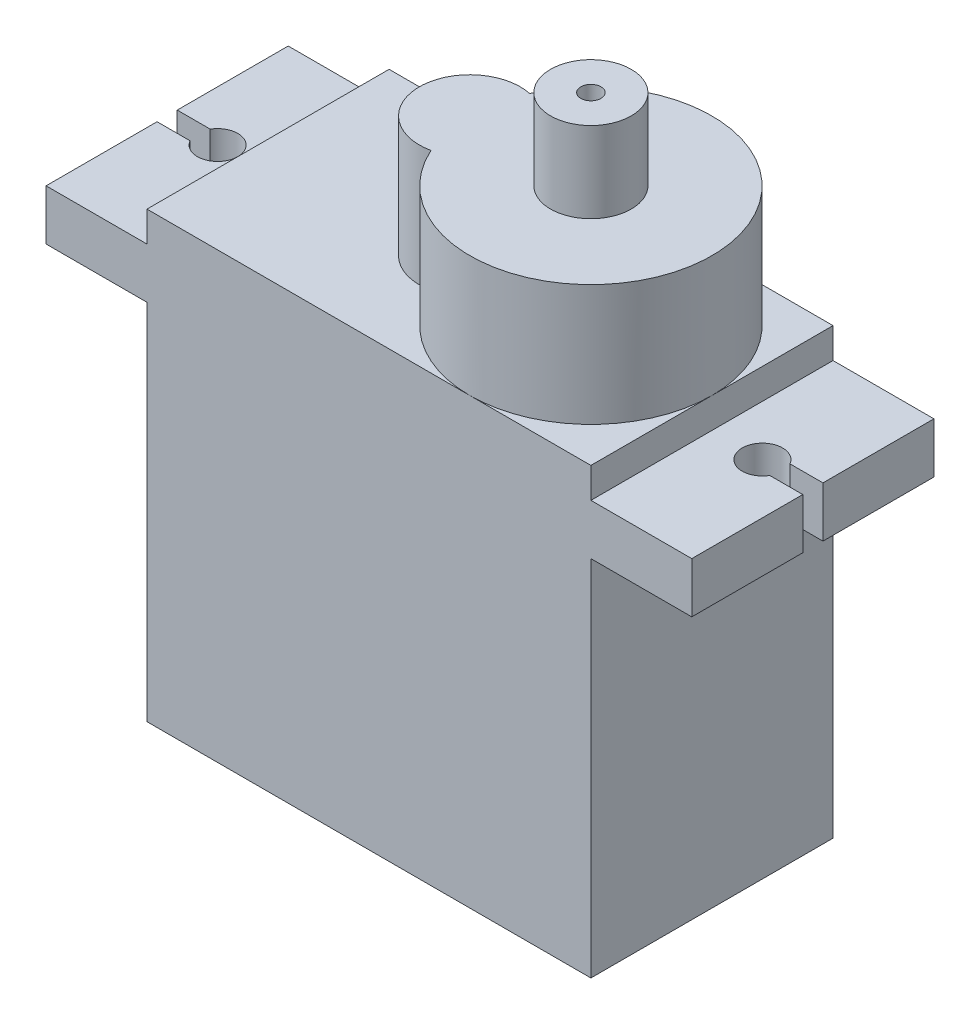
from build123d import *

# Parameters (mm, degrees)
EXTRUDE_5_DEPTH     = 12
EXTRUDE_6_DEPTH     = 6
SKETCH_11_R         = 2
SKETCH_11_R_2       = 0.5
EXTRUDE_7_DEPTH     = 4
CUT_EXTRUDE_4_DEPTH = 3
SKETCH_15_R         = 0.5
CUT_EXTRUDE_5_DEPTH = 38.735924528


with BuildPart() as part:
    # 草图9 → 凸台-拉伸5 (new body)
    with BuildSketch(Plane.XY):
        Polygon((11, -16.590909091), (-11, -16.590909091), (-11, 1.409090909), (-16, 1.409090909), (-16, 3.909090909), (-11, 3.909090909), (-11, 5.409090909), (11, 5.409090909), (11, 3.909090909), (16, 3.909090909), (16, 1.409090909), (11, 1.409090909), align=None)
    extrude(amount=EXTRUDE_5_DEPTH)

    # 草图10 → 凸台-拉伸6 (add)
    with BuildSketch(Plane(origin=(0, 5.409090909, 0), x_dir=(-1, 0, 0), z_dir=(0, -1, 0))):
        with BuildLine():
            ThreePointArc((0.479166667, -3.554855293), (-11, -6), (0.479166667, -8.445144707))
            ThreePointArc((0.479166667, -8.445144707), (3.5, -6), (0.479166667, -3.554855293))
        make_face()
    extrude(amount=-EXTRUDE_6_DEPTH)

    # 草图11 → 凸台-拉伸7 (add)
    with BuildSketch(Plane(origin=(0, 11.409090909, 0), x_dir=(-1, 0, 0), z_dir=(0, -1, 0))):
        with Locations(Location((-5, -6, 0), (0, 0, 90))):
            Circle(SKETCH_11_R)
        with Locations(Location((-5, -6, 0), (0, 0, 90))):
            Circle(SKETCH_11_R_2, mode=Mode.SUBTRACT)
    extrude(amount=-EXTRUDE_7_DEPTH)

    # 草图13 → 切除-拉伸4 (cut)
    with BuildSketch(Plane(origin=(0, 3.909090909, 0), x_dir=(-1, 0, 0), z_dir=(0, -1, 0))):
        with BuildLine():
            Line((-14.366025404, -6.5), (-16, -6.5))
            Line((-16, -6.5), (-16, -5.5))
            Line((-16, -5.5), (-14.366025404, -5.5))
            ThreePointArc((-14.366025404, -5.5), (-12.5, -6), (-14.366025404, -6.5))
        make_face()
        with BuildLine():
            Line((14.366025404, -5.5), (16, -5.5))
            Line((16, -5.5), (16, -6.5))
            Line((16, -6.5), (14.366025404, -6.5))
            ThreePointArc((14.366025404, -6.5), (12.5, -6), (14.366025404, -5.5))
        make_face()
    extrude(amount=CUT_EXTRUDE_4_DEPTH, mode=Mode.SUBTRACT)

    # 草图15 → 切除-拉伸5 (cut, through all)
    with BuildSketch(Plane(origin=(0, 15.409090909, 0), x_dir=(1, 0, 0), z_dir=(0, 1, 0))):
        with Locations(Location((5, -6, 0), (0, 0, 90))):
            Circle(SKETCH_15_R)
    extrude(amount=-CUT_EXTRUDE_5_DEPTH, mode=Mode.SUBTRACT)


solid = part.part
